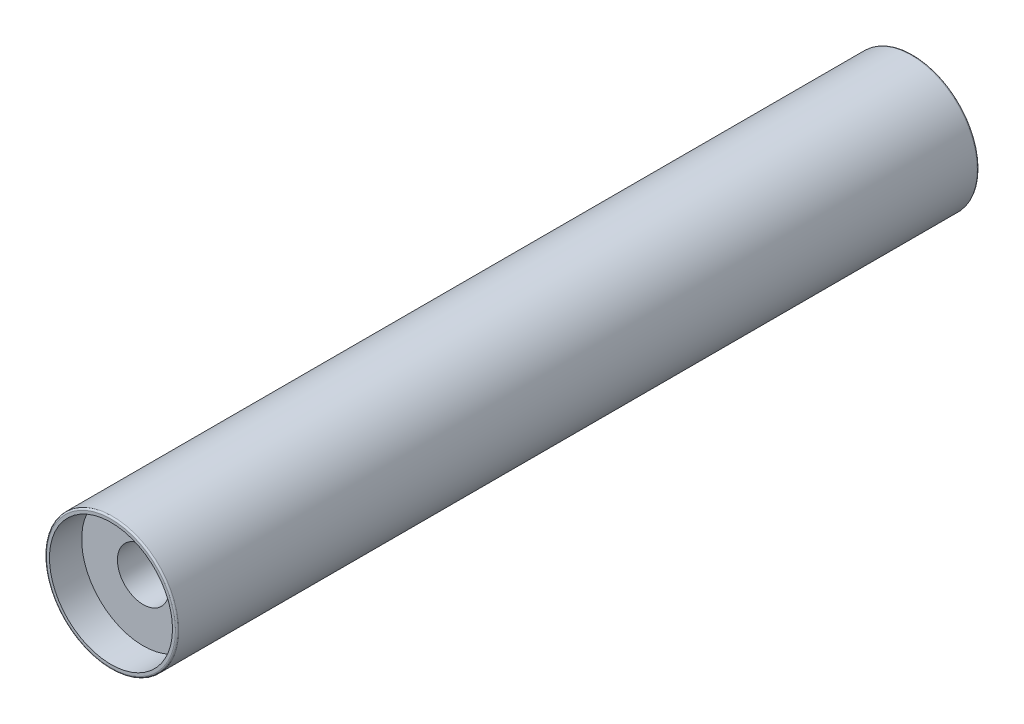
from build123d import *

# Parameters (mm, degrees)
BASE_EXTRUDE_DEPTH      = 62.2325
BASE_EXTRUDE_DEPTH_BACK = 62.2325
SKETCH1_R               = 10.25
STROKECHAMBER_START     = -46.95
SKETCH2_R               = 9.525
STROKECHAMBER_DEPTH     = 93.9
RODBORE_DEPTH           = 64.898427651
RODBORE_DEPTH_BACK      = 64.898427651
SKETCH3_R               = 4
FILLET1_R               = 0.25
SKETCH4_R               = 9.55
CUT_EXTRUDE1_DEPTH      = 5


with BuildPart() as part:
    # Sketch1 → Base-Extrude (new, two sides: drawn at the far end of the back side and taken through both)
    with BuildSketch(Plane.XY.offset(-BASE_EXTRUDE_DEPTH_BACK)):
        Circle(SKETCH1_R)
    extrude(amount=BASE_EXTRUDE_DEPTH + BASE_EXTRUDE_DEPTH_BACK)

    # Sketch2 → StrokeChamber (cut)
    with BuildSketch(Plane.XY.offset(STROKECHAMBER_START)):
        Circle(SKETCH2_R)
    extrude(amount=STROKECHAMBER_DEPTH, mode=Mode.SUBTRACT)

    # Sketch3 → RodBore (cut, two sides: drawn at the far end of the back side and taken through both)
    with BuildSketch(Plane.XY.offset(-RODBORE_DEPTH_BACK)):
        Circle(SKETCH3_R)
    extrude(amount=RODBORE_DEPTH + RODBORE_DEPTH_BACK, mode=Mode.SUBTRACT)

    # Fillet1
    fillet1_edges = [part.edges().sort_by_distance(p)[0] for p in [
        (-10.25, 0, -62.2325),
        (-10.25, 0, 62.2325),
    ]]
    fillet(fillet1_edges, radius=FILLET1_R)

    # Sketch4 → Cut-Extrude1 (cut)
    with BuildSketch(Plane.XY.offset(62.2325)):
        Circle(SKETCH4_R)
    cut_extrude1 = extrude(amount=-CUT_EXTRUDE1_DEPTH, mode=Mode.SUBTRACT)

    # Mirror1: Cut-Extrude1 across plane
    add(cut_extrude1.mirror(Plane.XY), mode=Mode.SUBTRACT)


solid = part.part
